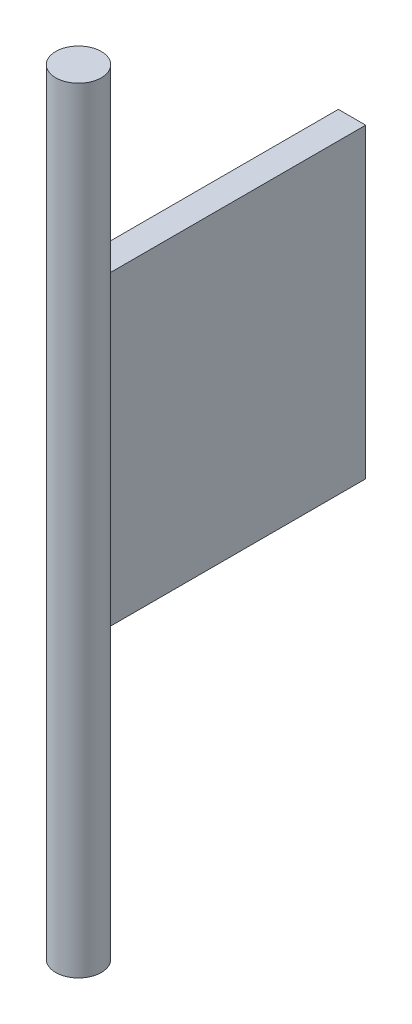
from build123d import *

# Parameters (mm, degrees)
CROQUIS1_W                   = 30
CROQUIS1_H                   = 33.6
SALIENTE_EXTRUIR1_DEPTH      = 3
SALIENTE_EXTRUIR2_DEPTH      = 20
SALIENTE_EXTRUIR2_DEPTH_BACK = 65
CROQUIS2_R                   = 2.5


with BuildPart() as part:
    # Croquis1 → Saliente-Extruir1 (new body)
    with BuildSketch(Plane(origin=(0, 0, 0), x_dir=(0, 0, -1), z_dir=(1, 0, 0))):
        Rectangle(CROQUIS1_W, CROQUIS1_H)
    extrude(amount=SALIENTE_EXTRUIR1_DEPTH)

    # Croquis2 → Saliente-Extruir2 (add, two sides: drawn at the far end of the back side and taken through both)
    with BuildSketch(Plane(origin=(0, 16.8, 0), x_dir=(1, 0, 0), z_dir=(0, 1, 0)).offset(-SALIENTE_EXTRUIR2_DEPTH_BACK)):
        with Locations(Location((1.5, -15, 0), (0, 0, 270))):
            Circle(CROQUIS2_R)
    extrude(amount=SALIENTE_EXTRUIR2_DEPTH + SALIENTE_EXTRUIR2_DEPTH_BACK)


solid = part.part
